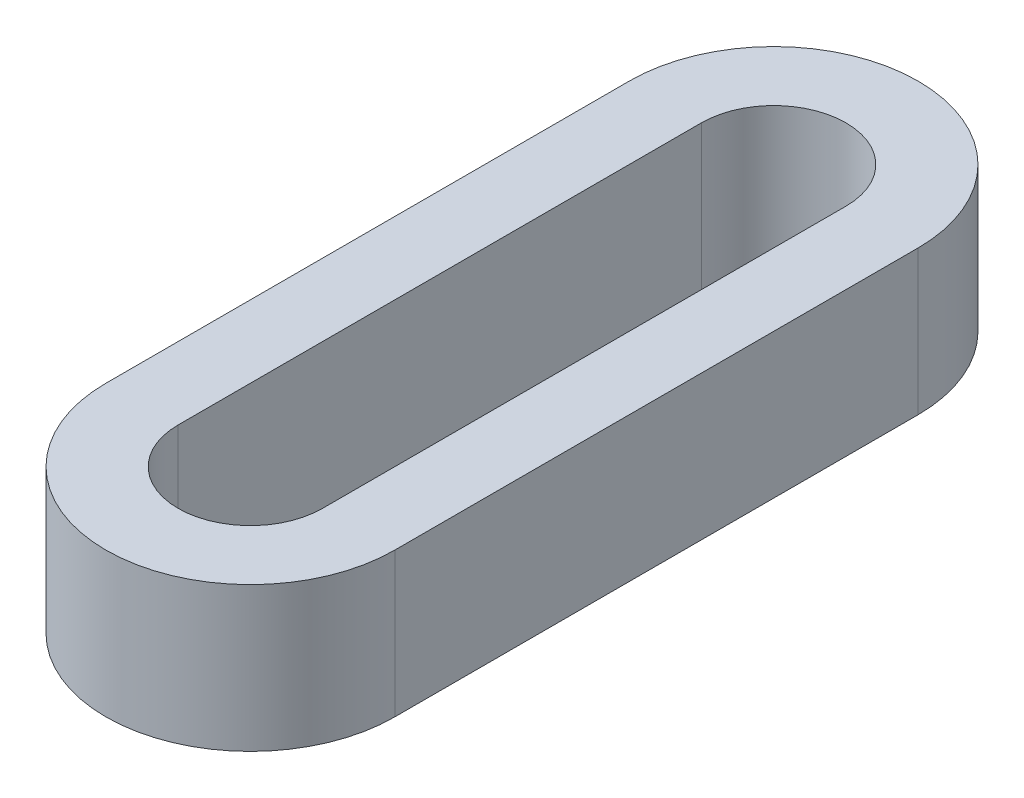
from build123d import *

# Parameters (mm, degrees)
BOSS_EXTRUDE1_DEPTH = 5


with BuildPart() as part:
    # Sketch1 → Boss-Extrude1 (new body)
    with BuildSketch(Plane(origin=(0, 0, 0), x_dir=(1, 0, 0), z_dir=(0, 1, 0))):
        with BuildLine():
            Line((-5, -9.056523547), (-5, 9.056523547))
            ThreePointArc((-5, 9.056523547), (0, 14.056523547), (5, 9.056523547))
            Line((5, 9.056523547), (5, -9.056523547))
            ThreePointArc((5, -9.056523547), (0, -14.056523547), (-5, -9.056523547))
        make_face()
        with BuildLine():
            Line((-2.5, -9.056523547), (-2.5, 9.056523547))
            ThreePointArc((-2.5, 9.056523547), (0, 11.556523547), (2.5, 9.056523547))
            Line((2.5, 9.056523547), (2.5, -9.056523547))
            ThreePointArc((2.5, -9.056523547), (0, -11.556523547), (-2.5, -9.056523547))
        make_face(mode=Mode.SUBTRACT)
    extrude(amount=BOSS_EXTRUDE1_DEPTH)


solid = part.part
